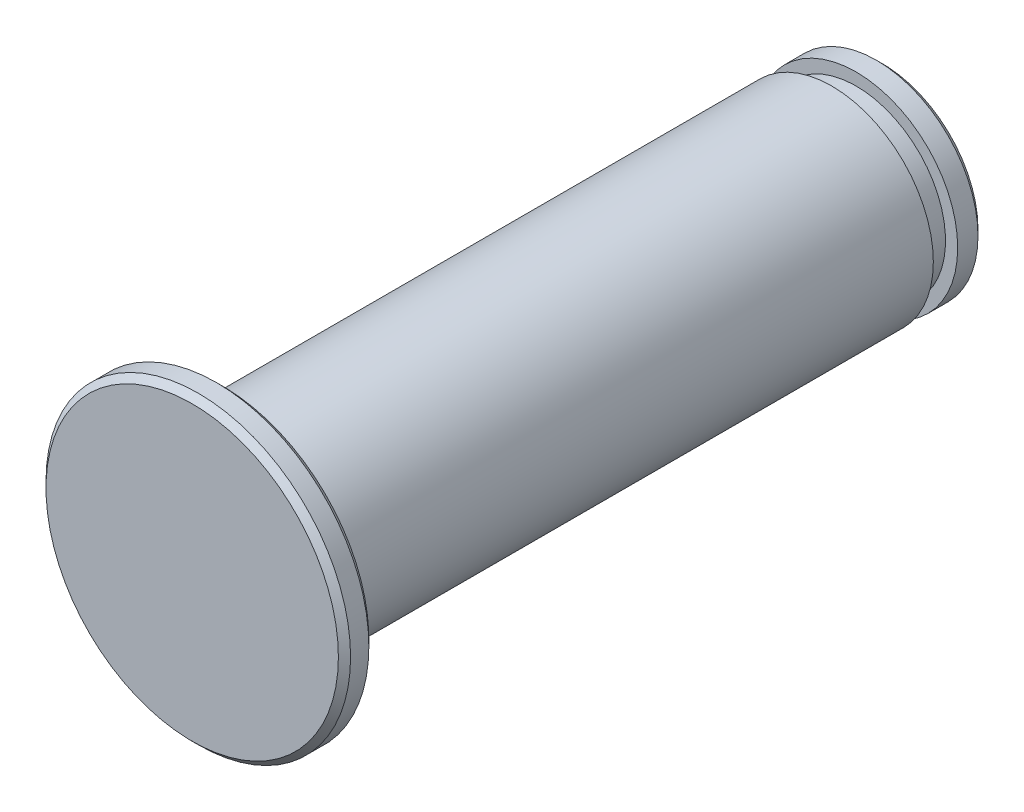
from build123d import *

# Parameters (mm, degrees)
CHAMFER1_SIZE = 0.3


with BuildPart() as part:
    # Sketch1 → Revolve1 (revolve)
    with BuildSketch(Plane(origin=(0, 0, 0), x_dir=(1, 0, 0), z_dir=(0, 1, 0))):
        Polygon((0, -17.618415179), (-7.5, -17.618415179), (-7.5, -16.118415179), (-5, -16.118415179), (-5, 13.881584821), (-4.4, 13.881584821), (-4.4, 15.081584821), (-5, 15.081584821), (-5, 16.381584821), (0, 16.381584821), align=None)
    revolve(axis=Axis((0, 0, -34.457254464), (0, 0, 1)))

    # Chamfer1
    chamfer1_edges = [part.edges().sort_by_distance(p)[0] for p in [
        (5, 0, -16.381584821),
        (7.5, 0, 16.118415179),
        (7.5, 0, 17.618415179),
    ]]
    chamfer(chamfer1_edges, length=CHAMFER1_SIZE)


solid = part.part
